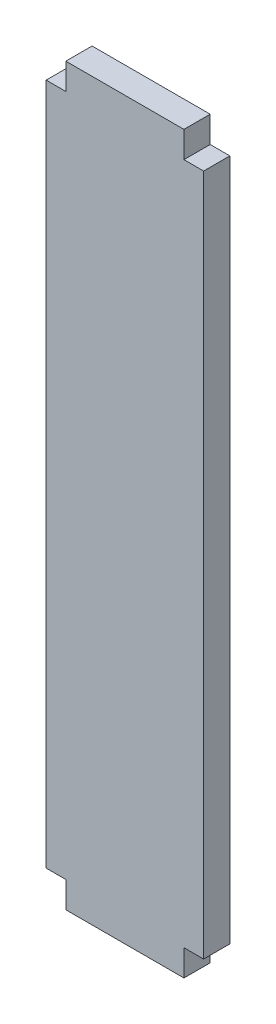
from build123d import *

# Parameters (mm, degrees)
EXTRUDE_1_DEPTH = 2


with BuildPart() as part:
    # 草图1 → 凸台-拉伸1 (new body)
    with BuildSketch(Plane.XY):
        Polygon((2314.880354297, 1090.41049495), (2314.880354297, 1088.41049495), (2313.380354297, 1088.41049495), (2313.380354297, 1036.41049495), (2314.880354297, 1036.41049495), (2314.880354297, 1034.41049495), (2323.880354297, 1034.41049495), (2323.880354297, 1036.41049495), (2325.380354297, 1036.41049495), (2325.380354297, 1088.41049495), (2323.880354297, 1088.41049495), (2323.880354297, 1090.41049495), align=None)
    extrude(amount=EXTRUDE_1_DEPTH)


solid = part.part
